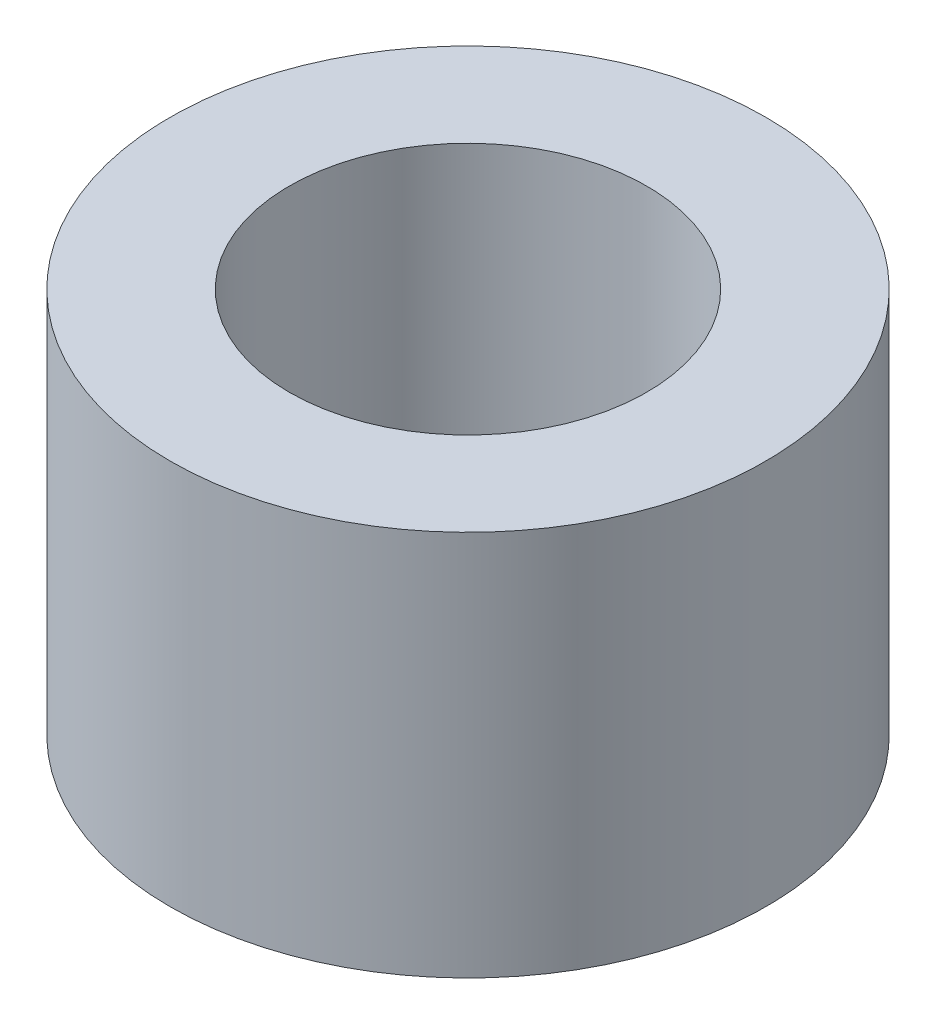
from build123d import *

# Parameters (mm, degrees)
SKETCH1_R           = 15.875
SKETCH1_R_2         = 9.525
BOSS_EXTRUDE1_DEPTH = 10.287


with BuildPart() as part:
    # Sketch1 → Boss-Extrude1 (new, symmetric)
    with BuildSketch(Plane(origin=(0, 0, 0), x_dir=(1, 0, 0), z_dir=(0, 1, 0))):
        with Locations(Location((0, 0, 0), (0, 0, 270))):
            Circle(SKETCH1_R)
        with Locations(Location((0, 0, 0), (0, 0, 270))):
            Circle(SKETCH1_R_2, mode=Mode.SUBTRACT)
    extrude(amount=BOSS_EXTRUDE1_DEPTH, both=True)


solid = part.part
